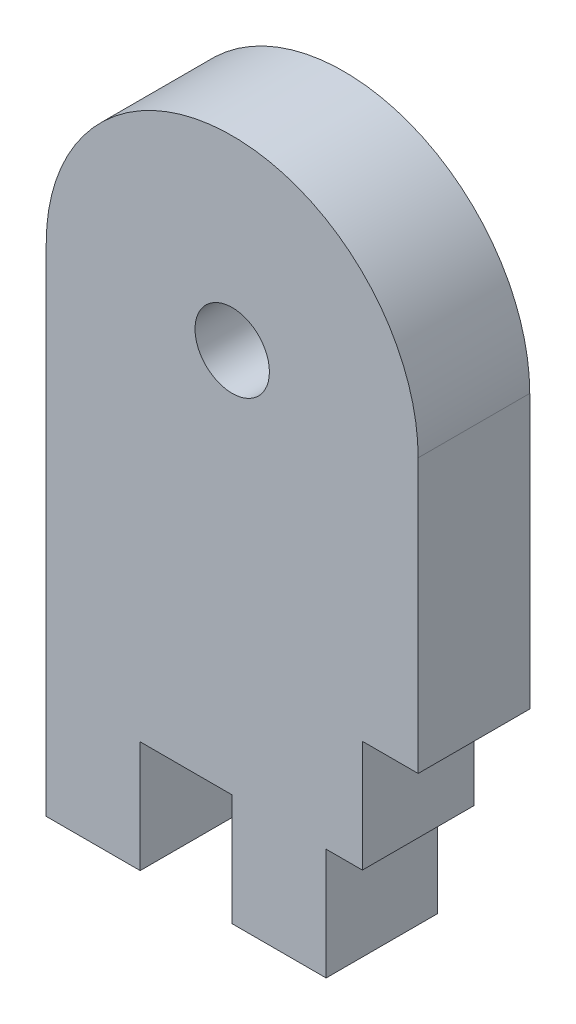
from build123d import *

# Parameters (mm, degrees)
ESQUISSE1_R        = 2
BOSS_EXTRU_1_DEPTH = 6


with BuildPart() as part:
    # Esquisse1 → Boss.-Extru.1 (new body)
    with BuildSketch(Plane.XY):
        with BuildLine():
            Line((0, 0), (0, 26.7))
            ThreePointArc((0, 26.7), (10, 36.7), (20, 26.7))
            Line((20, 26.7), (20, 12))
            Line((20, 12), (17, 12))
            Line((17, 12), (17, 6))
            Line((17, 6), (15.05, 6))
            Line((15.05, 6), (15.05, 0))
            Line((15.05, 0), (10, 0))
            Line((10, 0), (10, 6))
            Line((10, 6), (5.05, 6))
            Line((5.05, 6), (5.05, 0))
            Line((5.05, 0), (0, 0))
        make_face()
        with Locations((10, 26.7)):
            Circle(ESQUISSE1_R, mode=Mode.SUBTRACT)
    extrude(amount=BOSS_EXTRU_1_DEPTH)


solid = part.part
